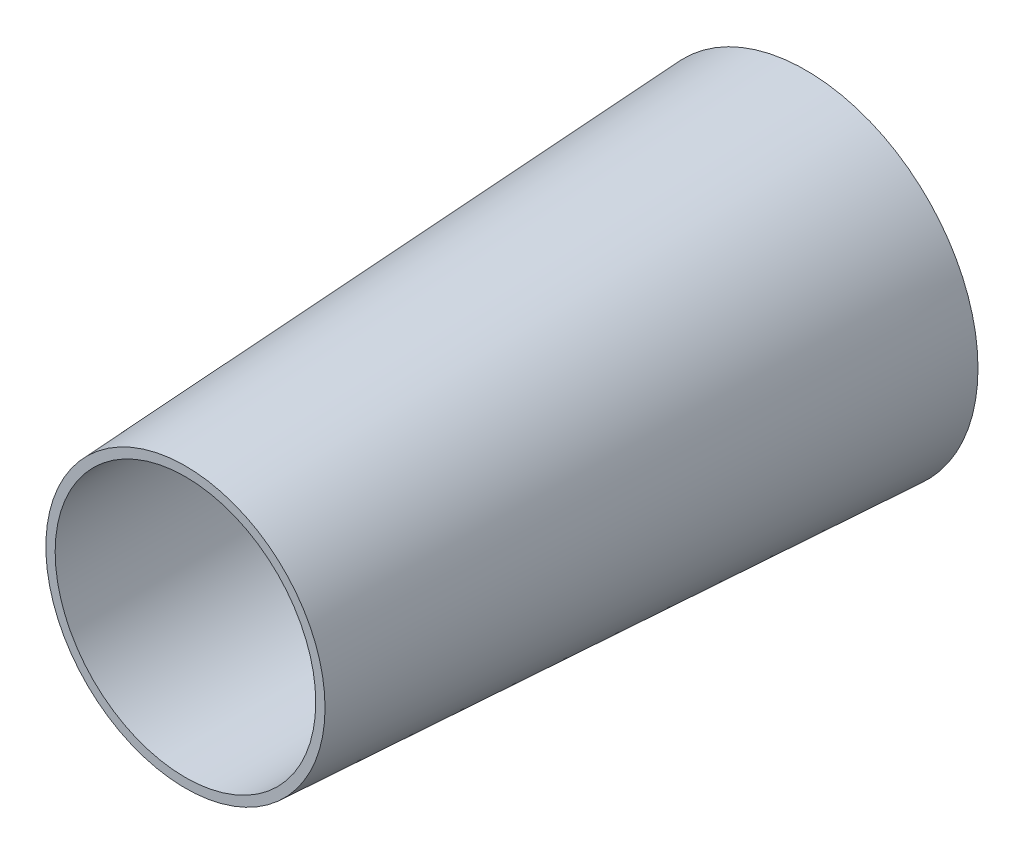
from build123d import *

# Parameters (mm, degrees)
SKETCH1_R          = 22.5
BOSS_EXTRUDE_DEPTH = 100
DRAFT3_ANGLE       = 3
SKETCH2_R          = 21
CUT_EXTRUDE1_DEPTH = 108.420210017


with BuildPart() as part:
    # Sketch1 → Boss-Extrude (new body)
    with BuildSketch(Plane.XY):
        Circle(SKETCH1_R)
    extrude(amount=BOSS_EXTRUDE_DEPTH)

    # Draft3
    draft3_faces = [part.faces().sort_by_distance(p)[0] for p in [
        (-22.5, 0, 50),
    ]]
    draft(draft3_faces, Plane.XY.offset(100), DRAFT3_ANGLE)

    # Sketch2 → Cut-Extrude1 (cut, through all)
    with BuildSketch(Plane(origin=(0, 0, 0), x_dir=(-1, 0, 0), z_dir=(0, 0, -1))):
        Circle(SKETCH2_R)
    extrude(amount=-CUT_EXTRUDE1_DEPTH, mode=Mode.SUBTRACT)


solid = part.part
